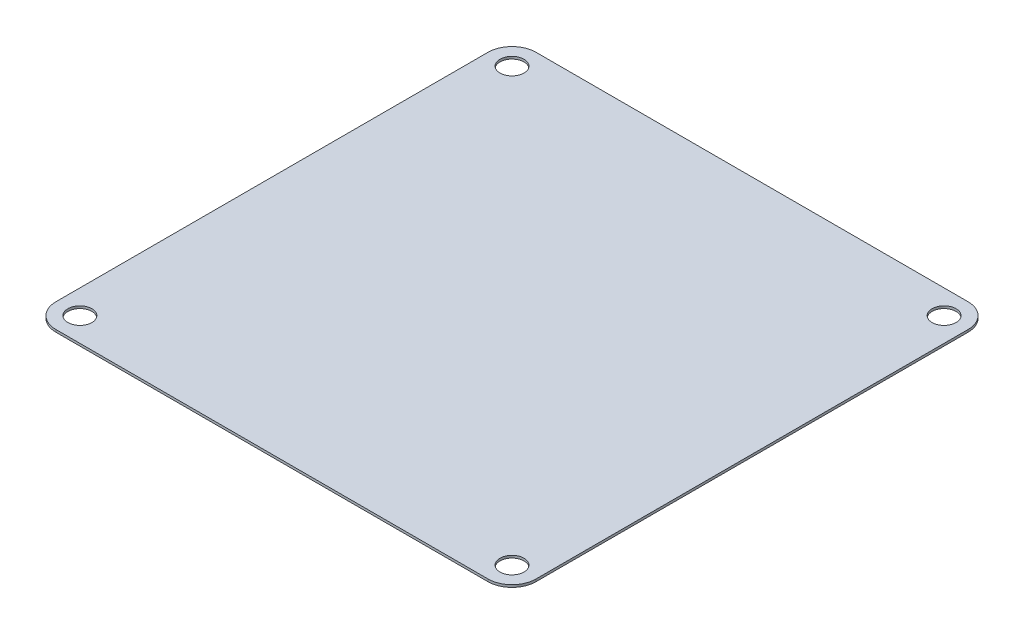
from build123d import *

# Parameters (mm, degrees)
SKETCH3_W           = 200
SKETCH3_H           = 200
BOSS_EXTRUDE1_DEPTH = 1
FILLET1_R           = 10
SKETCH4_R           = 5
CUT_EXTRUDE1_DEPTH  = 10


with BuildPart() as part:
    # Sketch3 → Boss-Extrude1 (new body)
    with BuildSketch(Plane(origin=(0, 0, 0), x_dir=(1, 0, 0), z_dir=(0, 1, 0))):
        with Locations((-50, -50)):
            Rectangle(SKETCH3_W, SKETCH3_H)
    extrude(amount=BOSS_EXTRUDE1_DEPTH)

    # Fillet1
    fillet1_edges = [part.edges().sort_by_distance(p)[0] for p in [
        (-150, 0.5, -50),
        (50, 0.5, -50),
        (50, 0.5, 150),
        (-150, 0.5, 150),
    ]]
    fillet(fillet1_edges, radius=FILLET1_R)

    # Sketch4 → Cut-Extrude1 (cut)
    with BuildSketch(Plane(origin=(0, 1, 0), x_dir=(1, 0, 0), z_dir=(0, 1, 0))):
        with Locations(Location((-140, 40, 0), (0, 0, 270))):
            Circle(SKETCH4_R)
        with Locations(Location((40, 40, 0), (0, 0, 270))):
            Circle(SKETCH4_R)
        with Locations(Location((-140, -140, 0), (0, 0, 270))):
            Circle(SKETCH4_R)
        with Locations(Location((40, -140, 0), (0, 0, 270))):
            Circle(SKETCH4_R)
    extrude(amount=-CUT_EXTRUDE1_DEPTH, mode=Mode.SUBTRACT)


solid = part.part
